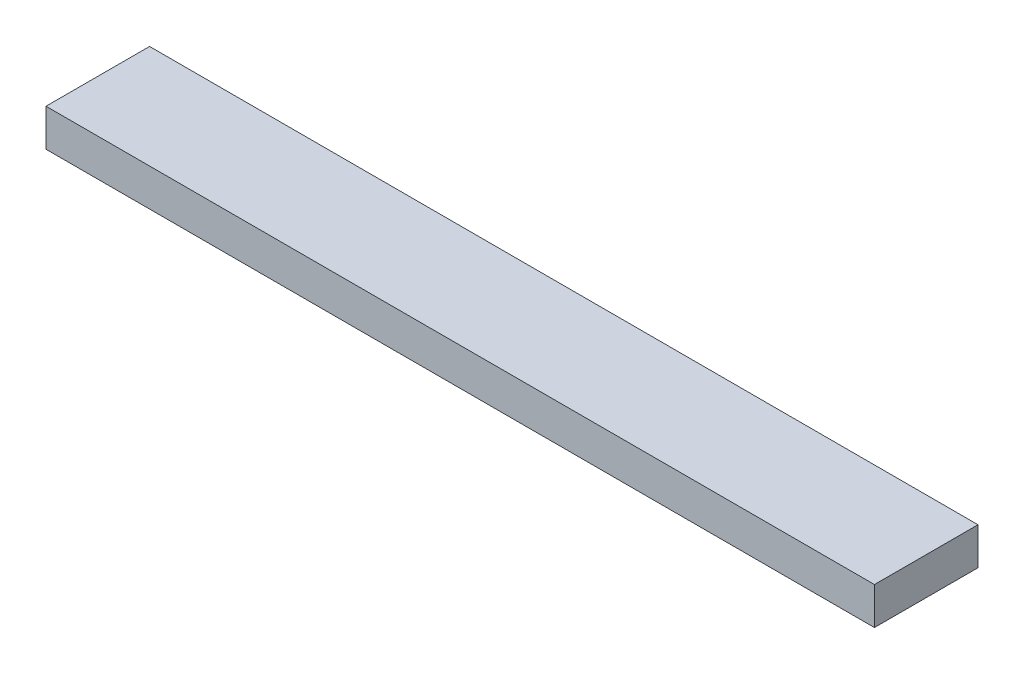
from build123d import *

# Parameters (mm, degrees)
SKETCH1_W           = 100
SKETCH1_H           = 12.5
BOSS_EXTRUDE1_DEPTH = 4.5


with BuildPart() as part:
    # Sketch1 → Boss-Extrude1 (new body)
    with BuildSketch(Plane(origin=(0, 0, 0), x_dir=(1, 0, 0), z_dir=(0, 1, 0))):
        Rectangle(SKETCH1_W, SKETCH1_H)
    extrude(amount=BOSS_EXTRUDE1_DEPTH)


solid = part.part
